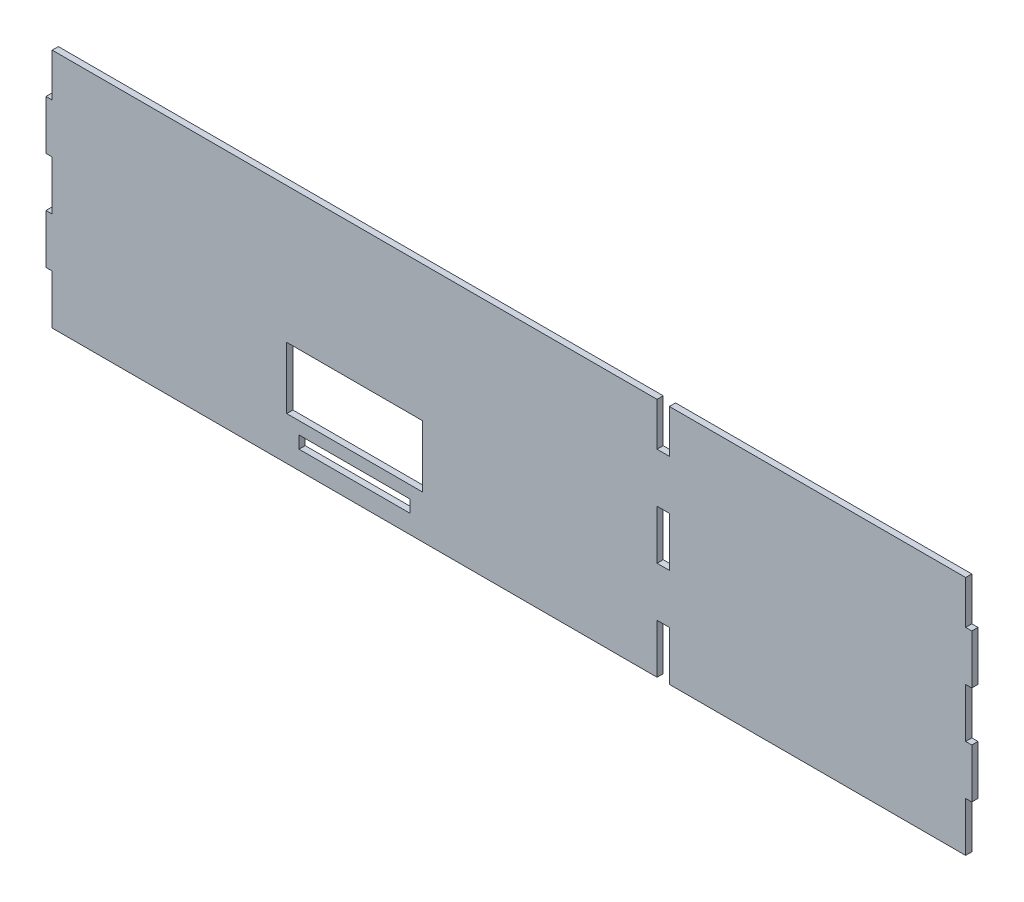
from build123d import *

# Parameters (mm, degrees)
ESQUISSE1_W             = 110
ESQUISSE1_H             = 50
BOSS_EXTRU_1_DEPTH      = 5
ENL_V_MAT_EXTRU_1_REACH = 776.952
ESQUISSE2_W             = 90
ESQUISSE2_H             = 10


with BuildPart() as part:
    # Esquisse1 → Boss.-Extru.1 (new body)
    # profile 1 of 2: a face of its own
    with BuildSketch(Plane.XY):
        Polygon((745, 120), (750, 120), (750, 160), (745, 160), (745, 195), (505, 195), (505, 160), (500, 160), (500, 120), (505, 120), (505, 80), (500, 80), (500, 40), (505, 40), (505, 0), (745, 0), (745, 40), (750, 40), (750, 80), (745, 80), align=None)
    # profile 2 of 2: a face of its own
    with BuildSketch(Plane.XY):
        Polygon((500, 120), (500, 160), (495, 160), (495, 195), (5, 195), (5, 160), (0, 160), (0, 120), (5, 120), (5, 80), (0, 80), (0, 40), (5, 40), (5, 0), (495, 0), (495, 40), (500, 40), (500, 80), (495, 80), (495, 120), align=None)
        with Locations((250, 60)):
            Rectangle(ESQUISSE1_W, ESQUISSE1_H, mode=Mode.SUBTRACT)
    extrude(amount=BOSS_EXTRU_1_DEPTH)

    # Esquisse2 → Enlèv. mat.-Extru.1 (cut, up to next)
    with BuildSketch(Plane.XY.offset(5), mode=Mode.PRIVATE) as enl_v_mat_extru_1_sk1:
        with Locations((250, 20)):
            Rectangle(ESQUISSE2_W, ESQUISSE2_H)
    enl_v_mat_extru_1_tool1 = extrude(enl_v_mat_extru_1_sk1.sketch, amount=-ENL_V_MAT_EXTRU_1_REACH, mode=Mode.PRIVATE) & part.part
    add(enl_v_mat_extru_1_tool1.solids().sort_by_distance((250, 20, 5))[0], mode=Mode.SUBTRACT)


solid = part.part
